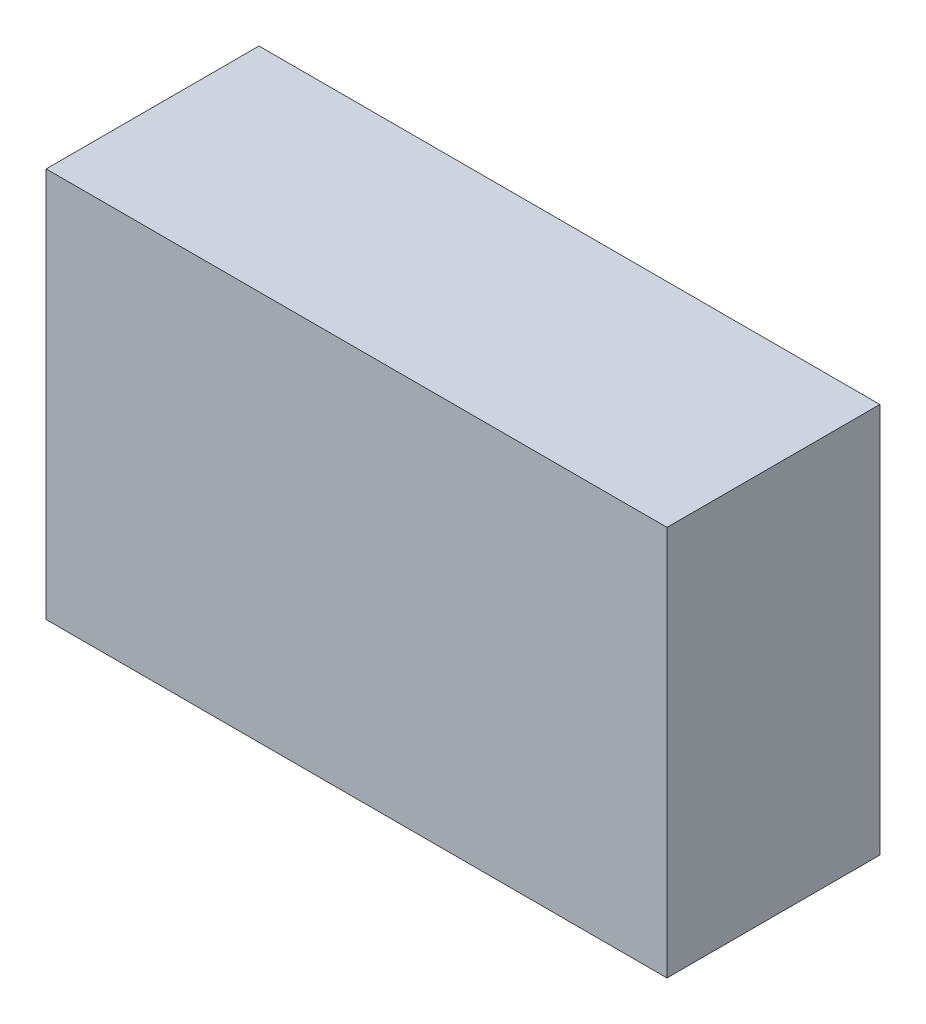
from build123d import *

# Parameters (mm, degrees)
SKETCH1_W           = 35
SKETCH1_H           = 22
BOSS_EXTRUDE1_DEPTH = 12


with BuildPart() as part:
    # Sketch1 → Boss-Extrude1 (new body)
    with BuildSketch(Plane.XY):
        Rectangle(SKETCH1_W, SKETCH1_H)
    extrude(amount=BOSS_EXTRUDE1_DEPTH)


solid = part.part
